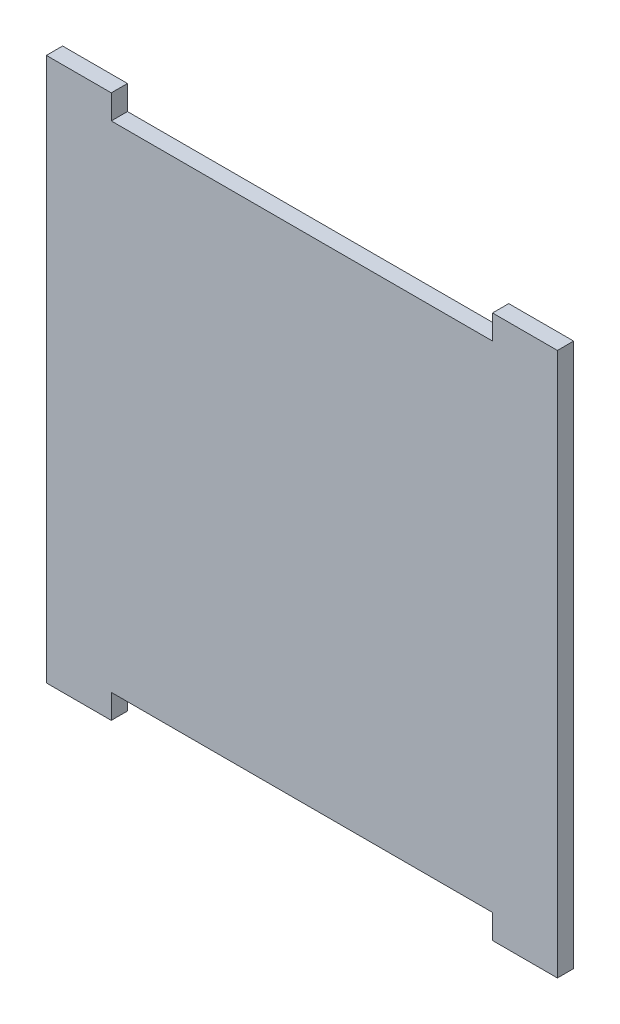
from build123d import *

# Parameters (mm, degrees)
SKETCH1_W          = 200.025
SKETCH1_H          = 212.725
EXTRUDE1_DEPTH     = 6.35
CUT_EXTRUDE1_REACH = 152.553
SKETCH2_W          = 149.225
SKETCH2_H          = 9.525


with BuildPart() as part:
    # Sketch1 → Extrude1 (new body)
    with BuildSketch(Plane.XY):
        with Locations((6.35, 0)):
            Rectangle(SKETCH1_W, SKETCH1_H)
    extrude(amount=EXTRUDE1_DEPTH)

    # Sketch2 → Cut-Extrude1 (cut, up to next)
    with BuildSketch(Plane.XY.offset(6.35), mode=Mode.PRIVATE) as cut_extrude1_sk1:
        with Locations((6.35, -101.6)):
            Rectangle(SKETCH2_W, SKETCH2_H)
    cut_extrude1_tool1 = extrude(cut_extrude1_sk1.sketch, amount=-CUT_EXTRUDE1_REACH, mode=Mode.PRIVATE) & part.part
    cut_extrude1 = cut_extrude1_tool1.solids().sort_by_distance((6.35, -101.6, 6.35))[0]
    add(cut_extrude1, mode=Mode.SUBTRACT)

    # Mirror1: Cut-Extrude1 across plane
    add(cut_extrude1.mirror(Plane.ZX), mode=Mode.SUBTRACT)


solid = part.part
